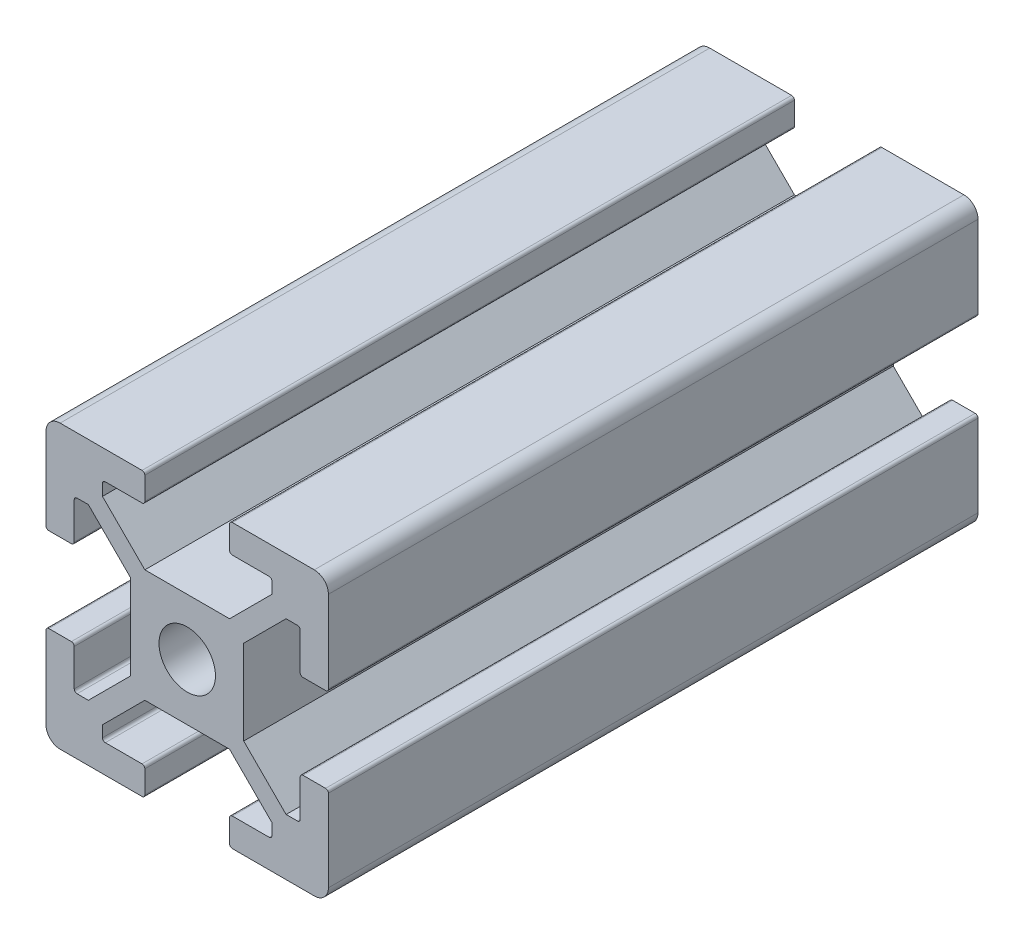
from build123d import *

# Parameters (mm, degrees)
SKETCH1_R           = 2
BOSS_EXTRUDE1_DEPTH = 46


with BuildPart() as part:
    # Sketch1 → Boss-Extrude1 (new body)
    with BuildSketch(Plane.XY):
        with BuildLine():
            Line((-3.2, 8), (-5.800532354, 8))
            ThreePointArc((-5.800532354, 8), (-5.941765118, 7.941609697), (-6.000531643, 7.800533062))
            Line((-6.000531643, 7.800533062), (-6.002658236, 7.002658236))
            Line((-6.002658236, 7.002658236), (-3, 4))
            Line((-3, 4), (3, 4))
            Line((3, 4), (6.002658236, 7.002658236))
            Line((6.002658236, 7.002658236), (6.000531643, 7.800533062))
            ThreePointArc((6.000531643, 7.800533062), (5.941765118, 7.941609697), (5.800532354, 8))
            Line((5.800532354, 8), (3.2, 8))
            ThreePointArc((3.2, 8), (3.058578644, 8.058578644), (3, 8.2))
            Line((3, 8.2), (3, 9.8))
            ThreePointArc((3, 9.8), (3.058578644, 9.941421356), (3.2, 10))
            Line((3.2, 10), (9, 10))
            ThreePointArc((9, 10), (9.707106781, 9.707106781), (10, 9))
            Line((10, 9), (10, 3.2))
            ThreePointArc((10, 3.2), (9.941421356, 3.058578644), (9.8, 3))
            Line((9.8, 3), (8.2, 3))
            ThreePointArc((8.2, 3), (8.058578644, 3.058578644), (8, 3.2))
            Line((8, 3.2), (8, 5.800532354))
            ThreePointArc((8, 5.800532354), (7.941609697, 5.941765118), (7.800533062, 6.000531643))
            Line((7.800533062, 6.000531643), (7.002658236, 6.002658236))
            Line((7.002658236, 6.002658236), (4, 3))
            Line((4, 3), (4, -3))
            Line((4, -3), (7.002658236, -6.002658236))
            Line((7.002658236, -6.002658236), (7.800533062, -6.000531643))
            ThreePointArc((7.800533062, -6.000531643), (7.941609697, -5.941765118), (8, -5.800532354))
            Line((8, -5.800532354), (8, -3.2))
            ThreePointArc((8, -3.2), (8.058578644, -3.058578644), (8.2, -3))
            Line((8.2, -3), (9.8, -3))
            ThreePointArc((9.8, -3), (9.941421356, -3.058578644), (10, -3.2))
            Line((10, -3.2), (10, -9))
            ThreePointArc((10, -9), (9.707106781, -9.707106781), (9, -10))
            Line((9, -10), (3.2, -10))
            ThreePointArc((3.2, -10), (3.058578644, -9.941421356), (3, -9.8))
            Line((3, -9.8), (3, -8.2))
            ThreePointArc((3, -8.2), (3.058578644, -8.058578644), (3.2, -8))
            Line((3.2, -8), (5.800532354, -8))
            ThreePointArc((5.800532354, -8), (5.941765118, -7.941609697), (6.000531643, -7.800533062))
            Line((6.000531643, -7.800533062), (6.002658236, -7.002658236))
            Line((6.002658236, -7.002658236), (3, -4))
            Line((3, -4), (-3, -4))
            Line((-3, -4), (-6.002658236, -7.002658236))
            Line((-6.002658236, -7.002658236), (-6.000531643, -7.800533062))
            ThreePointArc((-6.000531643, -7.800533062), (-5.941765118, -7.941609697), (-5.800532354, -8))
            Line((-5.800532354, -8), (-3.2, -8))
            ThreePointArc((-3.2, -8), (-3.058578644, -8.058578644), (-3, -8.2))
            Line((-3, -8.2), (-3, -9.8))
            ThreePointArc((-3, -9.8), (-3.058578644, -9.941421356), (-3.2, -10))
            Line((-3.2, -10), (-9, -10))
            ThreePointArc((-9, -10), (-9.707106781, -9.707106781), (-10, -9))
            Line((-10, -9), (-10, -3.2))
            ThreePointArc((-10, -3.2), (-9.941421356, -3.058578644), (-9.8, -3))
            Line((-9.8, -3), (-8.2, -3))
            ThreePointArc((-8.2, -3), (-8.058578644, -3.058578644), (-8, -3.2))
            Line((-8, -3.2), (-8, -5.800532354))
            ThreePointArc((-8, -5.800532354), (-7.941609697, -5.941765118), (-7.800533062, -6.000531643))
            Line((-7.800533062, -6.000531643), (-7.002658236, -6.002658236))
            Line((-7.002658236, -6.002658236), (-4, -3))
            Line((-4, -3), (-4, 3))
            Line((-4, 3), (-7.002658236, 6.002658236))
            Line((-7.002658236, 6.002658236), (-7.800533062, 6.000531643))
            ThreePointArc((-7.800533062, 6.000531643), (-7.941609697, 5.941765118), (-8, 5.800532354))
            Line((-8, 5.800532354), (-8, 3.2))
            ThreePointArc((-8, 3.2), (-8.058578644, 3.058578644), (-8.2, 3))
            Line((-8.2, 3), (-9.8, 3))
            ThreePointArc((-9.8, 3), (-9.941421356, 3.058578644), (-10, 3.2))
            Line((-10, 3.2), (-10, 9))
            ThreePointArc((-10, 9), (-9.707106781, 9.707106781), (-9, 10))
            Line((-9, 10), (-3.2, 10))
            ThreePointArc((-3.2, 10), (-3.058578644, 9.941421356), (-3, 9.8))
            Line((-3, 9.8), (-3, 8.2))
            ThreePointArc((-3, 8.2), (-3.058578644, 8.058578644), (-3.2, 8))
        make_face()
        Circle(SKETCH1_R, mode=Mode.SUBTRACT)
    extrude(amount=BOSS_EXTRUDE1_DEPTH)


solid = part.part
